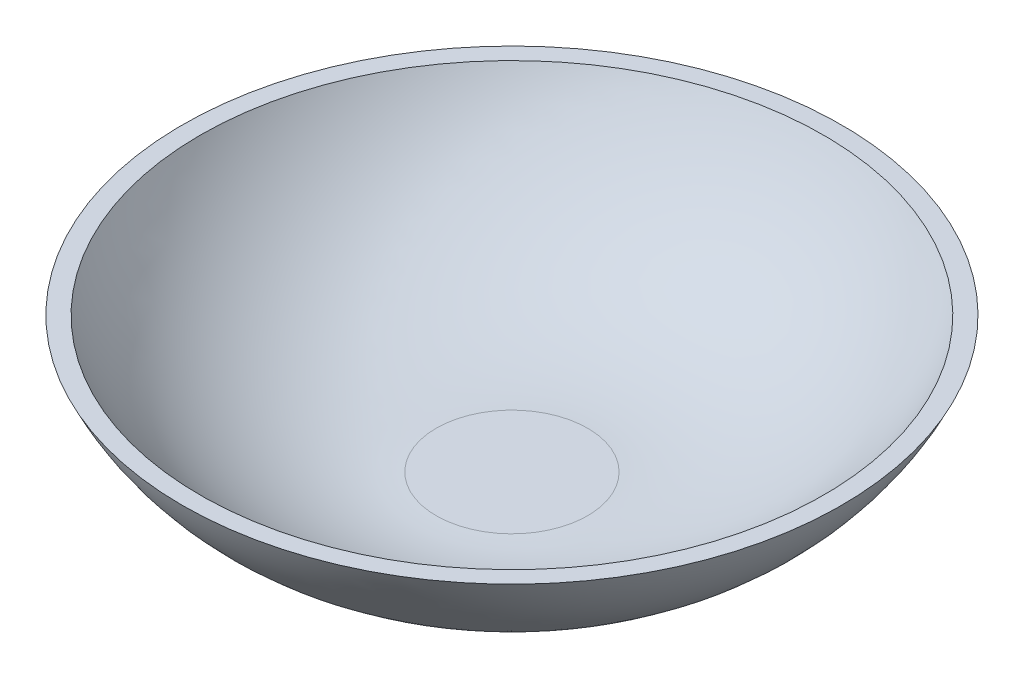
from build123d import *


with BuildPart() as part:
    # Эскиз3 → Повернуть1 (revolve)
    with BuildSketch(Plane.XY, mode=Mode.PRIVATE) as revolve_1_sk:
        with BuildLine():
            Line((0, 0), (16.5, 0))
            ThreePointArc((16.5, 0), (39.616429657, 6.858369735), (55.5, 25))
            Line((55.5, 25), (0, 25))
            Line((0, 25), (0, 0))
        make_face()
    revolve(revolve_1_sk.sketch.rotate(Axis((0, 25, 0), (0, -1, 0)), 90), axis=Axis((0, 25, 0), (0, -1, 0)))

    # Эскиз6 → Вырез-Повернуть1 (revolve, cut)
    with BuildSketch(Plane.XY, mode=Mode.PRIVATE) as cut_revolve_1_sk:
        with BuildLine():
            Line((0, 2.124596052), (12.761871667, 2.124596052))
            ThreePointArc((12.761871667, 2.124596052), (35.900187179, 7.883100849), (52.5, 25))
            Line((52.5, 25), (0, 25))
            Line((0, 25), (0, 2.124596052))
        make_face()
    revolve(cut_revolve_1_sk.sketch.rotate(Axis((0, 25, 0), (0, -1, 0)), 90), axis=Axis((0, 25, 0), (0, -1, 0)), mode=Mode.SUBTRACT)


solid = part.part
